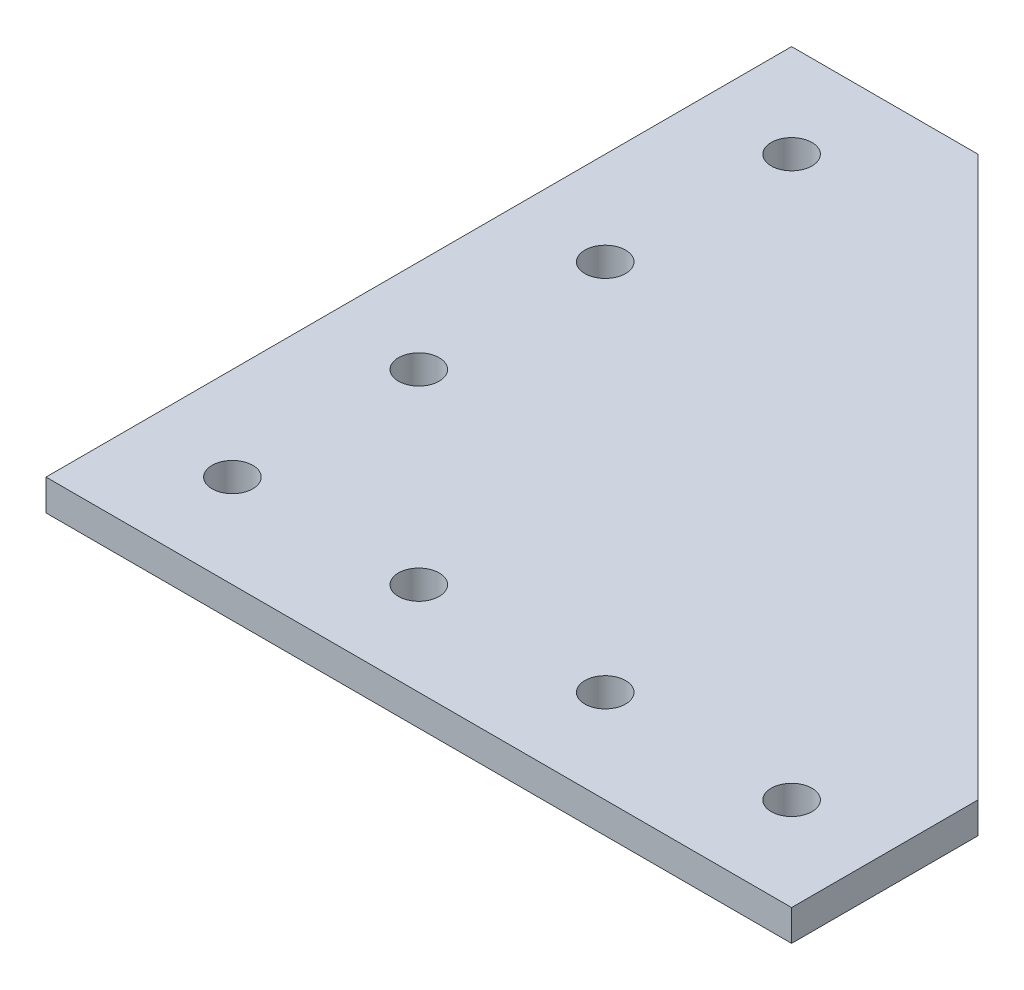
from build123d import *

# Parameters (mm, degrees)
SKETCH1_R           = 4.1656
BOSS_EXTRUDE2_DEPTH = 6.35


with BuildPart() as part:
    # Sketch1 → Boss-Extrude2 (new body)
    with BuildSketch(Plane(origin=(0, 0, 0), x_dir=(1, 0, 0), z_dir=(0, 1, 0))):
        Polygon((-103.302061856, 104.873195876), (-103.302061856, -47.526804124), (49.097938144, -47.526804124), (49.097938144, -9.426804124), (-65.202061856, 104.873195876), align=None)
        with Locations(Location((-84.252061856, 85.823195876, 0), (0, 0, 270))):
            Circle(SKETCH1_R, mode=Mode.SUBTRACT)
        with Locations(Location((-84.252061856, 47.723195876, 0), (0, 0, 270))):
            Circle(SKETCH1_R, mode=Mode.SUBTRACT)
        with Locations(Location((-84.252061856, 9.623195876, 0), (0, 0, 270))):
            Circle(SKETCH1_R, mode=Mode.SUBTRACT)
        with Locations(Location((-84.252061856, -28.476804124, 0), (0, 0, 270))):
            Circle(SKETCH1_R, mode=Mode.SUBTRACT)
        with Locations(Location((-46.152061856, -28.476804124, 0), (0, 0, 270))):
            Circle(SKETCH1_R, mode=Mode.SUBTRACT)
        with Locations(Location((-8.052061856, -28.476804124, 0), (0, 0, 270))):
            Circle(SKETCH1_R, mode=Mode.SUBTRACT)
        with Locations(Location((30.047938144, -28.476804124, 0), (0, 0, 270))):
            Circle(SKETCH1_R, mode=Mode.SUBTRACT)
    extrude(amount=BOSS_EXTRUDE2_DEPTH)


solid = part.part
